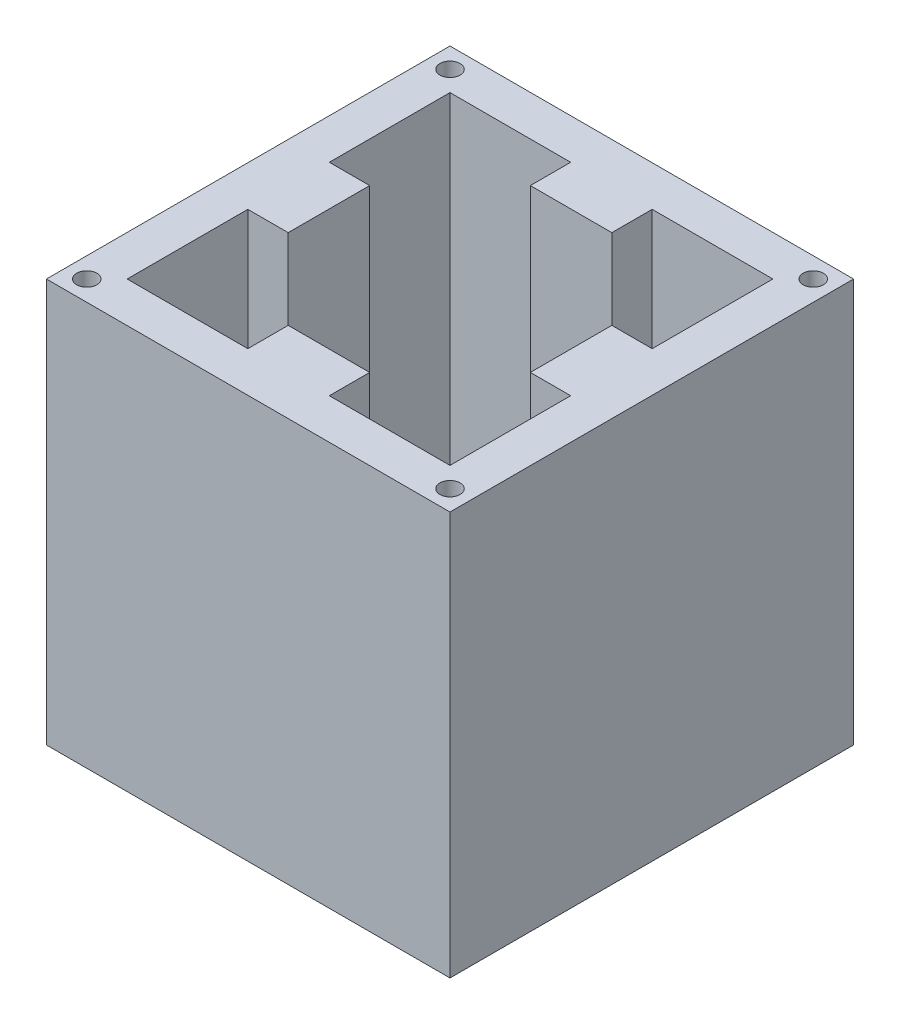
from build123d import *

# Parameters (mm, degrees)
SKETCH1_W           = 25.4
SKETCH1_H           = 25.4
BOSS_EXTRUDE1_DEPTH = 25.4
CUT_EXTRUDE2_DEPTH  = 22.86
SKETCH4_R           = 0.635
CUT_EXTRUDE4_DEPTH  = 7.62
SKETCH5_R           = 4.1275
BOSS_EXTRUDE2_DEPTH = 7.62
CHAMFER1_SIZE       = 1.27


with BuildPart() as part:
    # Sketch1 → Boss-Extrude1 (new body)
    with BuildSketch(Plane(origin=(0, 0, 0), x_dir=(1, 0, 0), z_dir=(0, 1, 0))):
        Rectangle(SKETCH1_W, SKETCH1_H)
    extrude(amount=BOSS_EXTRUDE1_DEPTH)

    # Sketch3 → Cut-Extrude2 (cut)
    with BuildSketch(Plane(origin=(0, 25.4, 0), x_dir=(1, 0, 0), z_dir=(0, 1, 0))):
        Polygon((10.16, 2.565122784), (7.62, 2.565122784), (7.62, -2.565122784), (10.16, -2.565122784), (10.16, -10.16), (2.565122784, -10.16), (2.565122784, -7.62), (-2.565122784, -7.62), (-2.565122784, -10.16), (-10.16, -10.16), (-10.16, -2.565122784), (-7.62, -2.565122784), (-7.62, 2.565122784), (-10.16, 2.565122784), (-10.16, 10.16), (-2.565122784, 10.16), (-2.565122784, 7.62), (2.565122784, 7.62), (2.565122784, 10.16), (10.16, 10.16), align=None)
    extrude(amount=-CUT_EXTRUDE2_DEPTH, mode=Mode.SUBTRACT)

    # Sketch4 → Cut-Extrude4 (cut)
    with BuildSketch(Plane(origin=(0, 25.4, 0), x_dir=(1, 0, 0), z_dir=(0, 1, 0))):
        with Locations(Location((11.43, 11.43, 0), (0, 0, 270))):
            Circle(SKETCH4_R)
        with Locations(Location((11.43, -11.43, 0), (0, 0, 270))):
            Circle(SKETCH4_R)
        with Locations(Location((-11.43, -11.43, 0), (0, 0, 270))):
            Circle(SKETCH4_R)
        with Locations(Location((-11.43, 11.43, 0), (0, 0, 270))):
            Circle(SKETCH4_R)
    extrude(amount=-CUT_EXTRUDE4_DEPTH, mode=Mode.SUBTRACT)

    # Sketch5 → Boss-Extrude2 (add)
    with BuildSketch(Plane(origin=(0, 2.54, 0), x_dir=(1, 0, 0), z_dir=(0, 1, 0))):
        with Locations(Location((0, 0, 0), (0, 0, 90))):
            Circle(SKETCH5_R)
    extrude(amount=BOSS_EXTRUDE2_DEPTH)

    # Chamfer1
    chamfer1_edges = [part.edges().sort_by_distance(p)[0] for p in [
        (0, 10.16, 4.1275),
    ]]
    chamfer(chamfer1_edges, length=CHAMFER1_SIZE)


solid = part.part
